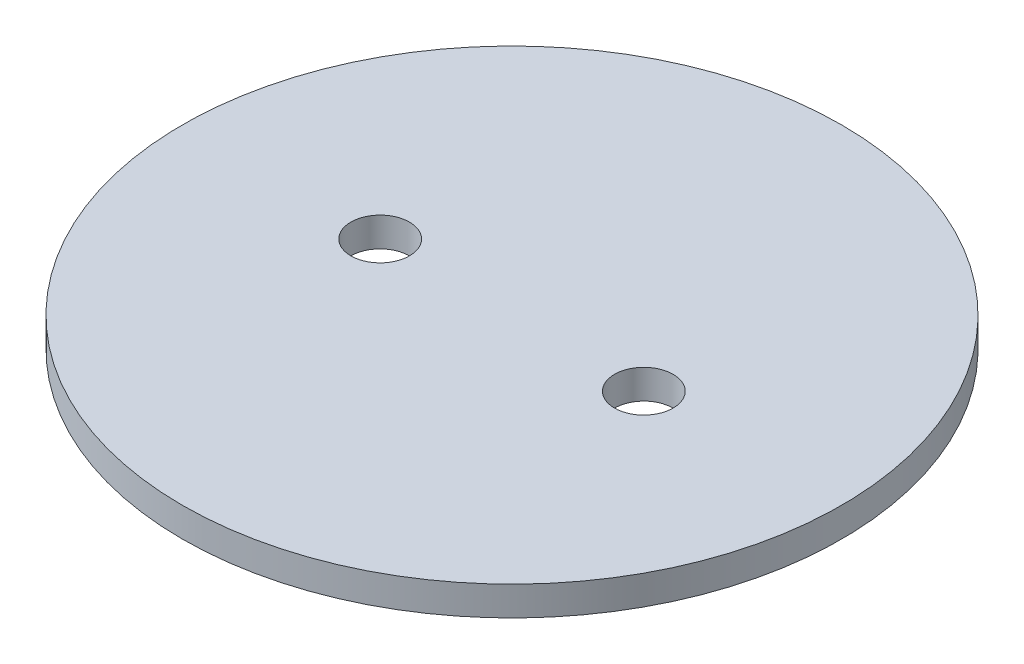
from build123d import *

# Parameters (mm, degrees)
SKETCH1_R           = 4.5
BOSS_EXTRUDE1_DEPTH = 0.5
SKETCH2_R           = 0.5
CUT_EXTRUDE1_DEPTH  = 7.383572667
BOSS_EXTRUDE2_START = -0.5
SKETCH3_R           = 5.625
SKETCH3_R_2         = 4.5
BOSS_EXTRUDE2_DEPTH = 0.5


with BuildPart() as part:
    # Sketch1 → Boss-Extrude1 (new body)
    with BuildSketch(Plane(origin=(0, 0, 0), x_dir=(1, 0, 0), z_dir=(0, 1, 0))):
        with Locations(Location((0, 0, 0), (0, 0, 270))):
            Circle(SKETCH1_R)
    extrude(amount=BOSS_EXTRUDE1_DEPTH)

    # Sketch2 → Cut-Extrude1 (cut, through all)
    with BuildSketch(Plane(origin=(0, 0.5, 0), x_dir=(1, 0, 0), z_dir=(0, 1, 0))):
        with Locations(Location((-2.25, 0, 0), (0, 0, 270))):
            Circle(SKETCH2_R)
        with Locations(Location((2.25, 0, 0), (0, 0, 270))):
            Circle(SKETCH2_R)
    extrude(amount=-CUT_EXTRUDE1_DEPTH, mode=Mode.SUBTRACT)

    # Sketch3 → Boss-Extrude2 (add)
    with BuildSketch(Plane(origin=(0, 0.5, 0), x_dir=(1, 0, 0), z_dir=(0, 1, 0)).offset(BOSS_EXTRUDE2_START)):
        with Locations(Location((0, 0, 0), (0, 0, 270))):
            Circle(SKETCH3_R)
        Circle(SKETCH3_R_2, mode=Mode.SUBTRACT)
    extrude(amount=BOSS_EXTRUDE2_DEPTH)


solid = part.part
